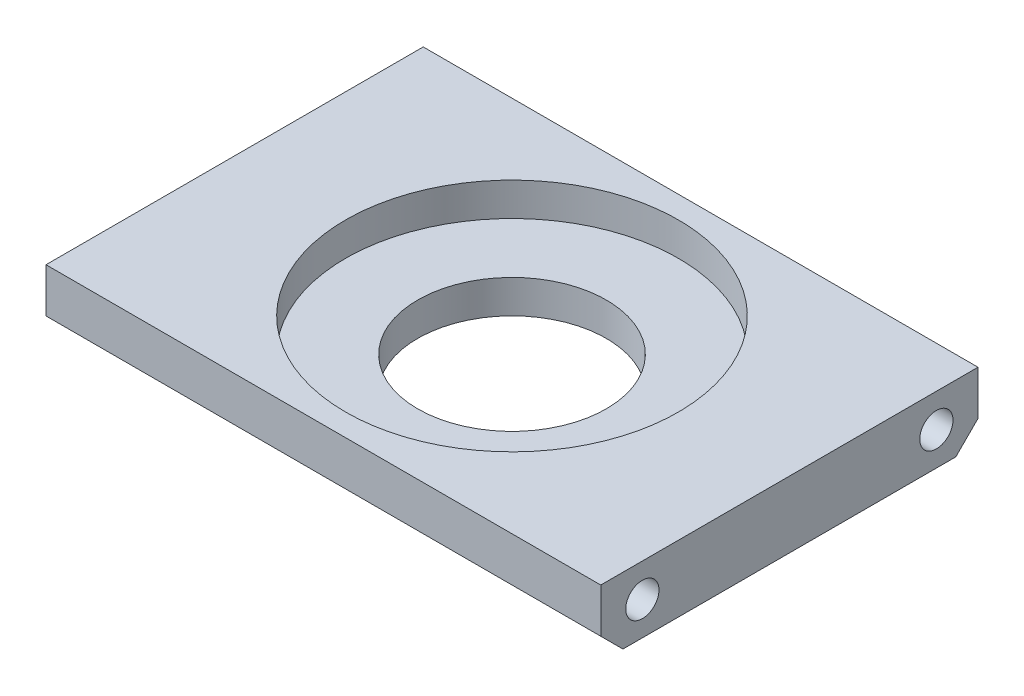
from build123d import *

# Parameters (mm, degrees)
SKETCH1_W           = 50
SKETCH1_H           = 34
BOSS_EXTRUDE1_DEPTH = 6
SKETCH2_R           = 1.5
CUT_EXTRUDE1_DEPTH  = 7
CUT_EXTRUDE2_START  = -7
SKETCH3_R           = 1.5
CUT_EXTRUDE2_DEPTH  = 7
CHAMFER2_SIZE       = 2
SKETCH4_R           = 15
CUT_EXTRUDE3_DEPTH  = 3
SKETCH5_R           = 8.5
CUT_EXTRUDE4_DEPTH  = 3


with BuildPart() as part:
    # Sketch1 → Boss-Extrude1 (new body)
    with BuildSketch(Plane(origin=(0, 0, 0), x_dir=(1, 0, 0), z_dir=(0, 1, 0))):
        with Locations((25, 17)):
            Rectangle(SKETCH1_W, SKETCH1_H)
    extrude(amount=BOSS_EXTRUDE1_DEPTH)

    # Sketch2 → Cut-Extrude1 (cut)
    with BuildSketch(Plane(origin=(50, 0, 0), x_dir=(0, 0, -1), z_dir=(1, 0, 0))):
        with Locations((3.75, 3)):
            Circle(SKETCH2_R)
        with Locations((30.25, 3)):
            Circle(SKETCH2_R)
    extrude(amount=-CUT_EXTRUDE1_DEPTH, mode=Mode.SUBTRACT)

    # Sketch3 → Cut-Extrude2 (cut)
    with BuildSketch(Plane.ZY.offset(CUT_EXTRUDE2_START)):
        with Locations(Location((-30.25, 3, 0), (0, 0, 180))):
            Circle(SKETCH3_R)
        with Locations(Location((-3.75, 3, 0), (0, 0, 180))):
            Circle(SKETCH3_R)
    extrude(amount=CUT_EXTRUDE2_DEPTH, mode=Mode.SUBTRACT)

    # Chamfer2
    chamfer2_edges = [part.edges().sort_by_distance(p)[0] for p in [
        (25, 0, -34),
        (25, 0, 0),
    ]]
    chamfer(chamfer2_edges, length=CHAMFER2_SIZE)

    # Sketch4 → Cut-Extrude3 (cut)
    with BuildSketch(Plane(origin=(0, 6, 0), x_dir=(1, 0, 0), z_dir=(0, 1, 0))):
        with Locations(Location((25, 17, 0), (0, 0, 270))):
            Circle(SKETCH4_R)
    extrude(amount=-CUT_EXTRUDE3_DEPTH, mode=Mode.SUBTRACT)

    # Sketch5 → Cut-Extrude4 (cut)
    with BuildSketch(Plane(origin=(0, 3, 0), x_dir=(1, 0, 0), z_dir=(0, 1, 0))):
        with Locations(Location((25, 17, 0), (0, 0, 270))):
            Circle(SKETCH5_R)
    extrude(amount=-CUT_EXTRUDE4_DEPTH, mode=Mode.SUBTRACT)


solid = part.part
